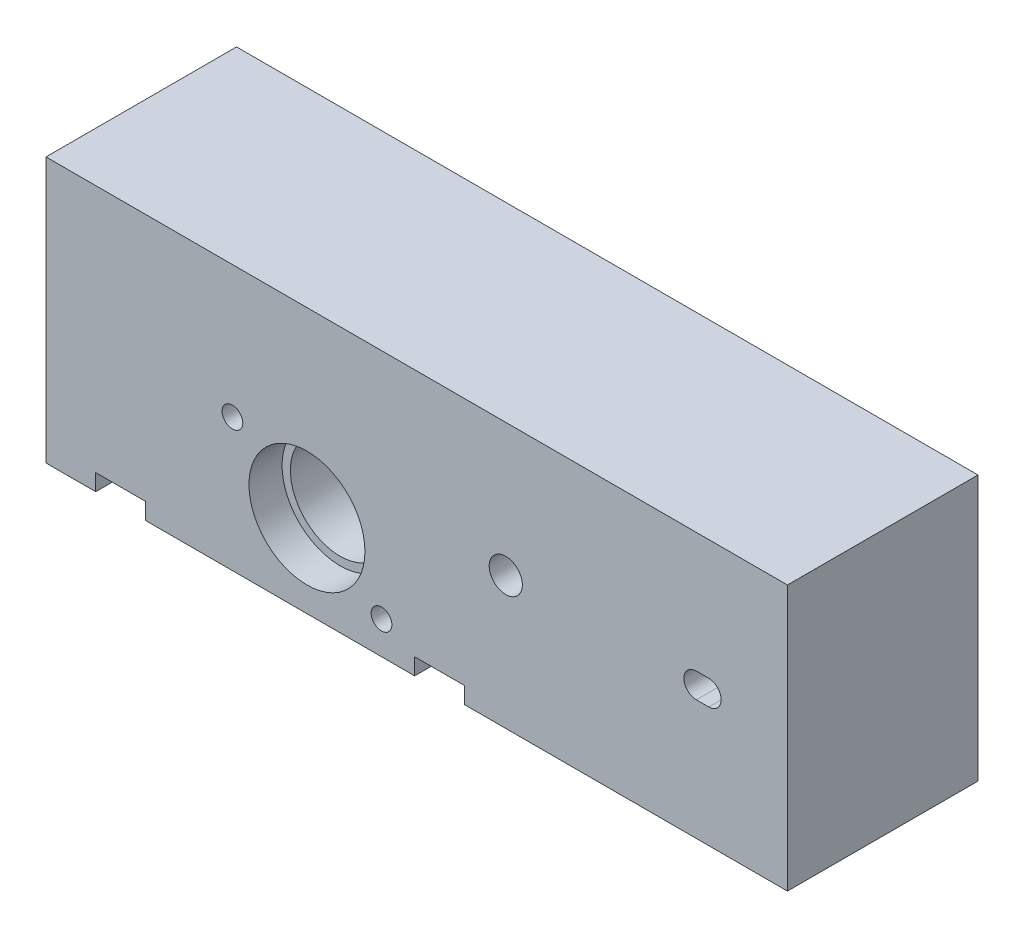
from build123d import *

# Parameters (mm, degrees)
SKETCH1_W           = 284.1625
SKETCH1_H           = 101.6
BOSS_EXTRUDE1_DEPTH = 73.025
SKETCH2_R           = 19.05
SKETCH2_R_2         = 4.7625
SKETCH2_R_3         = 3.96875
CUT_EXTRUDE1_DEPTH  = 168.631656397
SKETCH2_3_R         = 22.225
SKETCH2_3_R_2       = 6.35
CUT_EXTRUDE2_DEPTH  = 12.7
CUT_EXTRUDE3_START  = -31.75
SKETCH3_W           = 123.825
SKETCH3_H           = 38.1
SKETCH3_R           = 4.7625
CUT_EXTRUDE3_DEPTH  = 31.75
SKETCH3_3_W         = 19.05
SKETCH3_3_H         = 6.35
CUT_EXTRUDE4_DEPTH  = 168.631656397


with BuildPart() as part:
    # Sketch1 → Boss-Extrude1 (new body)
    with BuildSketch(Plane.XY):
        Rectangle(SKETCH1_W, SKETCH1_H)
    extrude(amount=BOSS_EXTRUDE1_DEPTH)

    # Sketch2 → Cut-Extrude1 (cut, through all)
    with BuildSketch(Plane.XY.offset(73.025)):
        with BuildLine():
            Line((111.91875, 4.7625), (107.15625, 4.7625))
            ThreePointArc((107.15625, 4.7625), (102.39375, 0), (107.15625, -4.7625))
            Line((107.15625, -4.7625), (111.91875, -4.7625))
            ThreePointArc((111.91875, -4.7625), (116.68125, 0), (111.91875, 4.7625))
        make_face()
        with Locations((-42.06875, -19.05)):
            Circle(SKETCH2_R)
        with Locations((34.13125, 0)):
            Circle(SKETCH2_R_2)
        with Locations((-13.499467703, -38.276580456)):
            Circle(SKETCH2_R_3)
        with Locations((-70.638032297, 0.176580456)):
            Circle(SKETCH2_R_3)
    extrude(amount=-CUT_EXTRUDE1_DEPTH, mode=Mode.SUBTRACT)

    # Sketch2<3> → Cut-Extrude2 (cut)
    with BuildSketch(Plane.XY.offset(73.025)):
        with Locations((-42.06875, -19.05)):
            Circle(SKETCH2_3_R)
        with Locations((34.13125, 0)):
            Circle(SKETCH2_3_R_2)
    extrude(amount=-CUT_EXTRUDE2_DEPTH, mode=Mode.SUBTRACT)

    # Sketch3 → Cut-Extrude3 (cut)
    with BuildSketch(Plane(origin=(0, 0, 0), x_dir=(-1, 0, 0), z_dir=(0, 0, -1)).offset(CUT_EXTRUDE3_START)):
        with Locations((-61.11875, 0)):
            Rectangle(SKETCH3_W, SKETCH3_H)
        with BuildLine():
            ThreePointArc((-107.15625, 4.7625), (-102.39375, 0), (-107.15625, -4.7625))
            Line((-107.15625, -4.7625), (-111.91875, -4.7625))
            ThreePointArc((-111.91875, -4.7625), (-116.68125, 0), (-111.91875, 4.7625))
            Line((-111.91875, 4.7625), (-107.15625, 4.7625))
        make_face(mode=Mode.SUBTRACT)
        with Locations((-34.13125, 0)):
            Circle(SKETCH3_R, mode=Mode.SUBTRACT)
    extrude(amount=CUT_EXTRUDE3_DEPTH, mode=Mode.SUBTRACT)

    # Sketch3<3> → Cut-Extrude4 (cut, through all)
    with BuildSketch(Plane(origin=(0, 0, 0), x_dir=(-1, 0, 0), z_dir=(0, 0, -1))):
        with Locations((-8.73125, -47.625)):
            Rectangle(SKETCH3_3_W, SKETCH3_3_H)
        with Locations((113.50625, -47.625)):
            Rectangle(SKETCH3_3_W, SKETCH3_3_H)
    extrude(amount=-CUT_EXTRUDE4_DEPTH, mode=Mode.SUBTRACT)


solid = part.part
